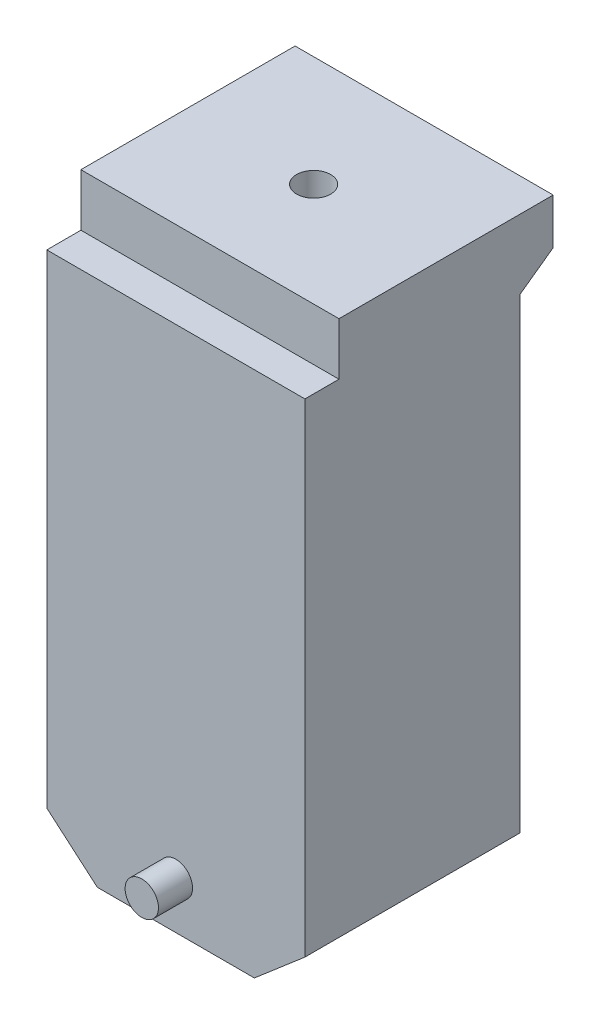
from build123d import *

# Parameters (mm, degrees)
BOSS_EXTRUDE1_DEPTH      = 75.75
CUT_EXTRUDE1_DEPTH       = 144.384624803
BOSS_EXTRUDE2_DEPTH      = 10
BOSS_EXTRUDE2_DEPTH_BACK = 73.12
SKETCH3_R                = 4.9
SKETCH4_R                = 5
CUT_EXTRUDE2_DEPTH       = 10
SKETCH5_W                = 2
SKETCH5_H                = 13.39
CUT_EXTRUDE3_DEPTH       = 137.266849467
SKETCH6_W                = 10
SKETCH6_H                = 2
CUT_EXTRUDE4_DEPTH       = 137.266849467


with BuildPart() as part:
    # Sketch1 → Boss-Extrude1 (new body)
    with BuildSketch(Plane(origin=(0, 0, 0), x_dir=(0, 0, -1), z_dir=(1, 0, 0))):
        Polygon((-39.615373705, 97.524665991), (15.504626295, 97.524665991), (25.254562849, 97.524665991), (25.254562849, 84.134665991), (15.504626295, 77.134665991), (15.504626295, -72.475334009), (-47.615373705, -72.475334009), (-47.615373705, 84.134665991), (-39.615373705, 84.134665991), align=None)
    extrude(amount=BOSS_EXTRUDE1_DEPTH)

    # Sketch2 → Cut-Extrude1 (cut, through all)
    with BuildSketch(Plane.XY.offset(47.615373705)):
        Polygon((0, -59.755334009), (14.83, -72.475334009), (0, -72.475334009), align=None)
        Polygon((75.75, -59.755334009), (60.92, -72.475334009), (75.75, -72.475334009), align=None)
    extrude(amount=-CUT_EXTRUDE1_DEPTH, mode=Mode.SUBTRACT)

    # Sketch3 → Boss-Extrude2 (add, two sides: drawn at the far end of the back side and taken through both)
    with BuildSketch(Plane.XY.offset(47.615373705).offset(-BOSS_EXTRUDE2_DEPTH_BACK)):
        with Locations((37.875, -58.705334009)):
            Circle(SKETCH3_R)
    extrude(amount=BOSS_EXTRUDE2_DEPTH + BOSS_EXTRUDE2_DEPTH_BACK)

    # Sketch4 → Cut-Extrude2 (cut)
    with BuildSketch(Plane(origin=(0, 97.524665991, 0), x_dir=(1, 0, 0), z_dir=(0, 1, 0))):
        with Locations(Location((37.875, -7.180405428, 0), (0, 0, 270))):
            Circle(SKETCH4_R)
    extrude(amount=-CUT_EXTRUDE2_DEPTH, mode=Mode.SUBTRACT)

    # Sketch5 → Cut-Extrude3 (cut, through all)
    with BuildSketch(Plane(origin=(75.75, 0, 0), x_dir=(0, 0, -1), z_dir=(1, 0, 0))):
        with Locations((-38.615373705, 90.829665991)):
            Rectangle(SKETCH5_W, SKETCH5_H)
    extrude(amount=-CUT_EXTRUDE3_DEPTH, mode=Mode.SUBTRACT)

    # Sketch6 → Cut-Extrude4 (cut, through all)
    with BuildSketch(Plane(origin=(75.75, 0, 0), x_dir=(0, 0, -1), z_dir=(1, 0, 0))):
        with Locations((-42.615373705, 83.134665991)):
            Rectangle(SKETCH6_W, SKETCH6_H)
    extrude(amount=-CUT_EXTRUDE4_DEPTH, mode=Mode.SUBTRACT)


solid = part.part
